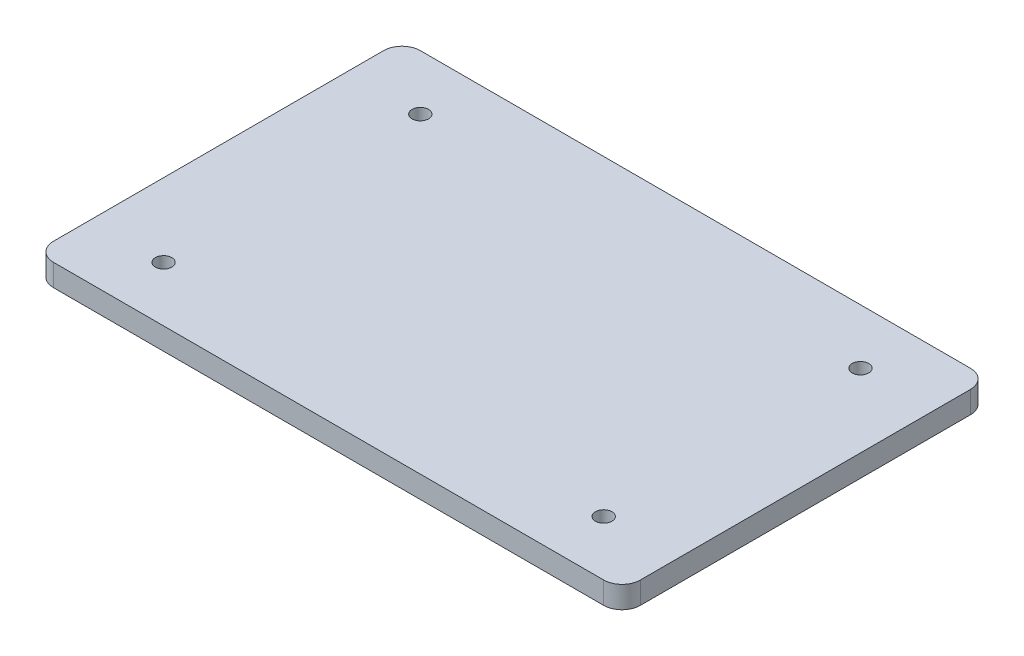
from build123d import *

# Parameters (mm, degrees)
SKETCH1_W                     = 160
SKETCH1_H                     = 100
BASEPLATE_160X100X6_DEPTH     = 6
CORNER_FILLET_R5_R            = 5
M4_ISOLATOR_CLEARANCE_HOLES_D = 4.5


with BuildPart() as part:
    # Sketch1 → BasePlate_160x100x6 (new body)
    with BuildSketch(Plane(origin=(0, 0, 0), x_dir=(1, 0, 0), z_dir=(0, 1, 0))):
        Rectangle(SKETCH1_W, SKETCH1_H)
    extrude(amount=BASEPLATE_160X100X6_DEPTH)

    # Corner_Fillet_R5
    corner_fillet_r5_edges = [part.edges().sort_by_distance(p)[0] for p in [
        (-80, 3, -50),
        (80, 3, -50),
        (80, 3, 50),
        (-80, 3, 50),
    ]]
    fillet(corner_fillet_r5_edges, radius=CORNER_FILLET_R5_R)

    # M4_Isolator_Clearance_Holes (through all)
    with Locations(Plane(origin=(0, 6, 0), x_dir=(1, 0, 0), z_dir=(0, 1, 0))):
        with Locations((-60, 35), (60, 35), (60, -35), (-60, -35)):
            Hole(M4_ISOLATOR_CLEARANCE_HOLES_D / 2)


solid = part.part
